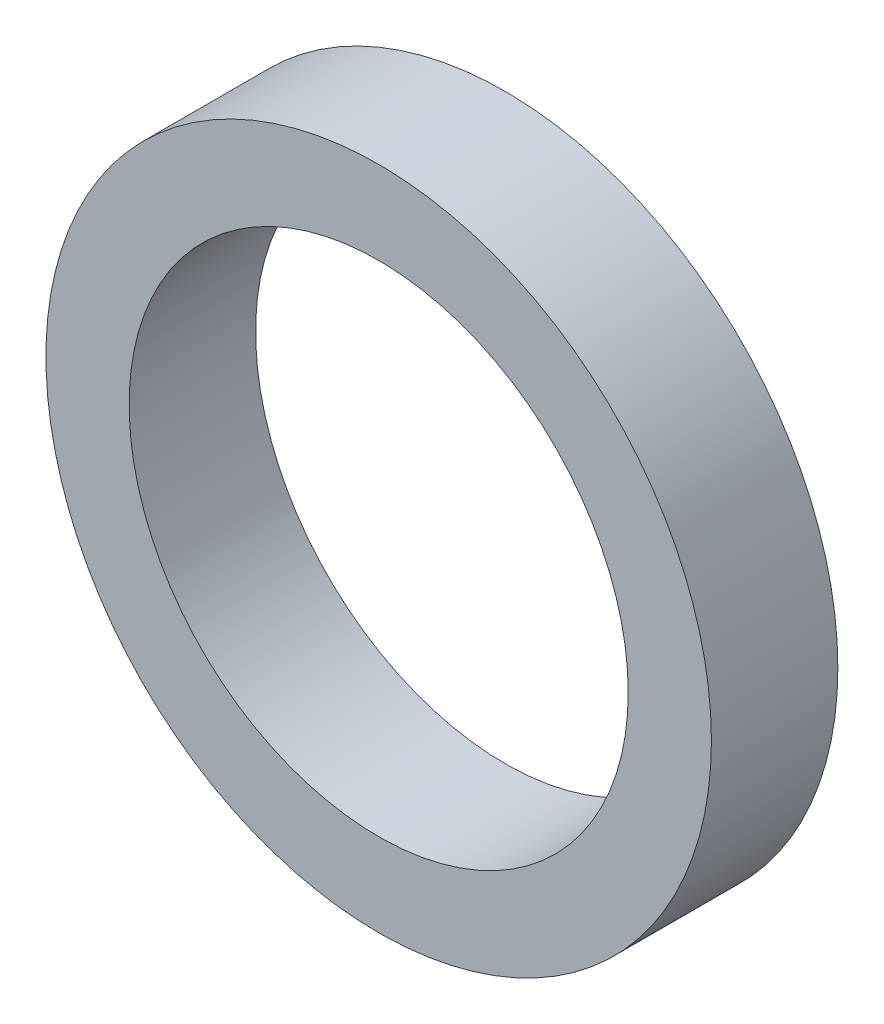
from build123d import *

# Parameters (mm, degrees)
SKIZZE1_R                       = 50
SKIZZE1_R_2                     = 37.5
AUFSATZ_LINEAR_AUSTRAGEN1_DEPTH = 19


with BuildPart() as part:
    # Skizze1 → Aufsatz-Linear austragen1 (new body)
    with BuildSketch(Plane.XY):
        Circle(SKIZZE1_R)
        Circle(SKIZZE1_R_2, mode=Mode.SUBTRACT)
    extrude(amount=AUFSATZ_LINEAR_AUSTRAGEN1_DEPTH)


solid = part.part
